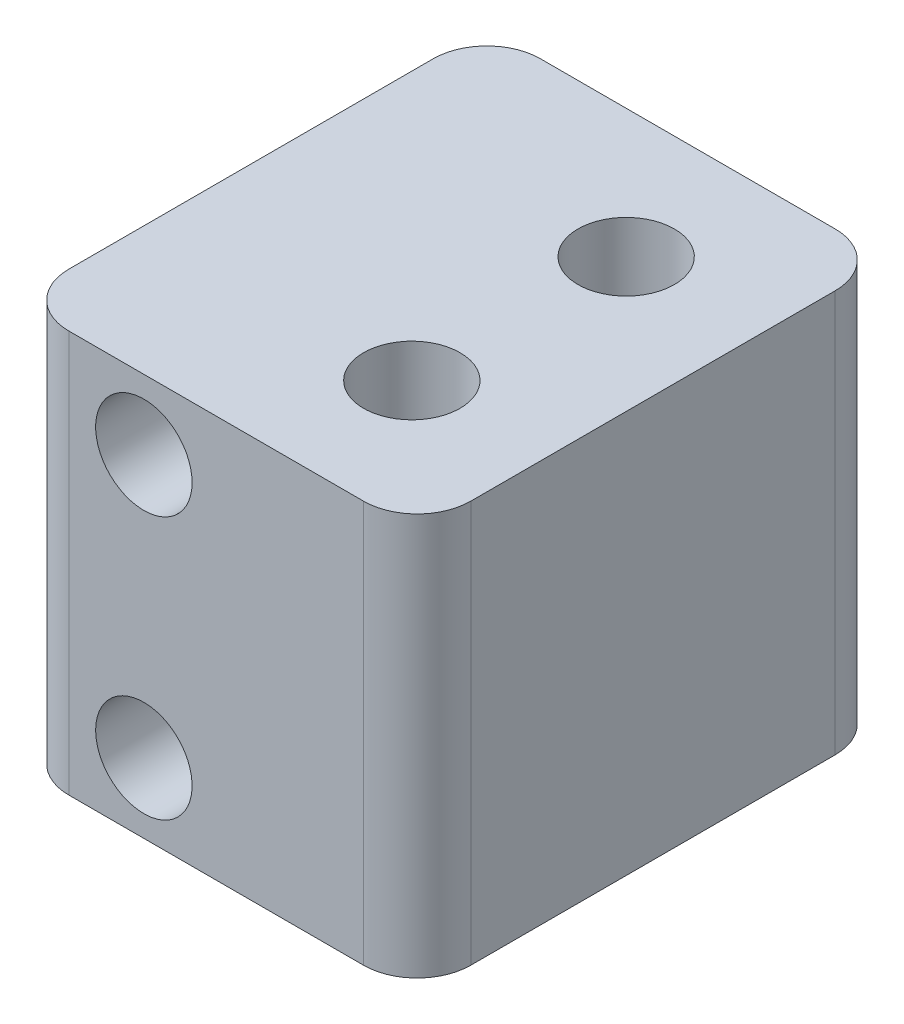
from build123d import *

# Parameters (mm, degrees)
SKETCH1_W           = 19.05
SKETCH1_H           = 22.352
SKETCH1_R           = 2.286
BOSS_EXTRUDE1_DEPTH = 19.05
FILLET1_R           = 2.54
FILLET2_R           = 2.54
SKETCH2_R           = 2.286
CUT_EXTRUDE1_DEPTH  = 31.874585487


with BuildPart() as part:
    # Sketch1 → Boss-Extrude1 (new body)
    with BuildSketch(Plane(origin=(0, 0, 0), x_dir=(1, 0, 0), z_dir=(0, 1, 0))):
        Rectangle(SKETCH1_W, SKETCH1_H)
        with Locations(Location((3.175, 5.08, 0), (0, 0, 90))):
            Circle(SKETCH1_R, mode=Mode.SUBTRACT)
        with Locations(Location((3.175, -5.08, 0), (0, 0, 90))):
            Circle(SKETCH1_R, mode=Mode.SUBTRACT)
    extrude(amount=BOSS_EXTRUDE1_DEPTH)

    # Fillet1
    fillet1_edges = [part.edges().sort_by_distance(p)[0] for p in [
        (9.525, 9.525, 11.176),
        (9.525, 9.525, -11.176),
    ]]
    fillet(fillet1_edges, radius=FILLET1_R)

    # Fillet2
    fillet2_edges = [part.edges().sort_by_distance(p)[0] for p in [
        (-9.525, 9.525, 11.176),
        (-9.525, 9.525, -11.176),
    ]]
    fillet(fillet2_edges, radius=FILLET2_R)

    # Sketch2 → Cut-Extrude1 (cut, through all)
    with BuildSketch(Plane.XY.offset(11.176)):
        with Locations((-3.429, 15.748)):
            Circle(SKETCH2_R)
        with Locations(Location((-3.429, 3.302, 0), (0, 0, 180))):
            Circle(SKETCH2_R)
    extrude(amount=-CUT_EXTRUDE1_DEPTH, mode=Mode.SUBTRACT)


solid = part.part
